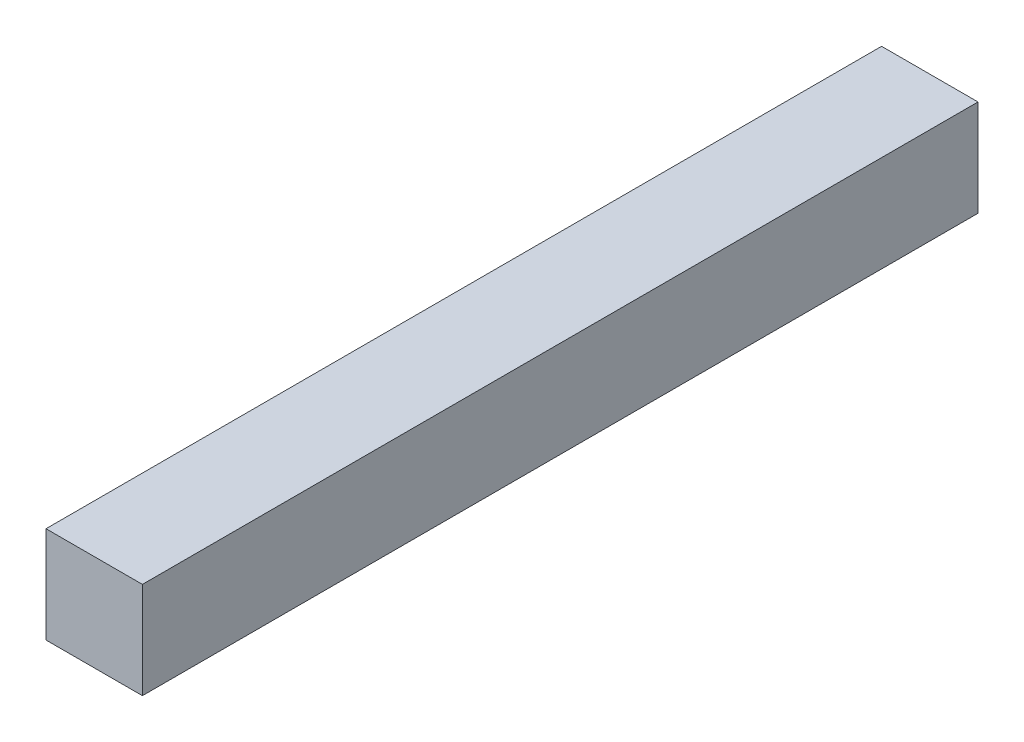
from build123d import *

# Parameters (mm, degrees)
SKETCH_1_W      = 30
SKETCH_1_H      = 30
EXTRUDE_1_DEPTH = 260


with BuildPart() as part:
    # 草圖1 → 填料-伸長1 (new body)
    with BuildSketch(Plane.XY):
        Rectangle(SKETCH_1_W, SKETCH_1_H)
    extrude(amount=EXTRUDE_1_DEPTH)


solid = part.part
